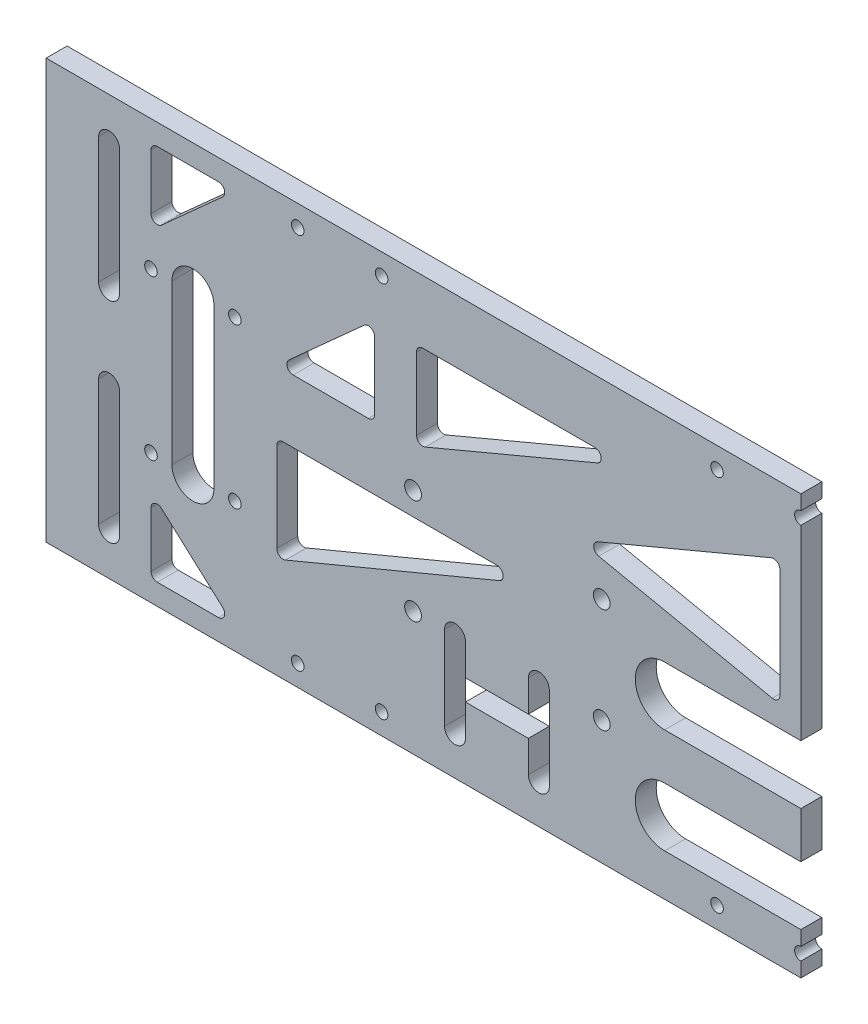
from build123d import *

# Parameters (mm, degrees)
SKETCH_1_W           = 320
SKETCH_1_H           = 121
EXTRUDE_1_DEPTH      = 5
SKETCH_2_W           = 5
SKETCH_2_H           = 30
CUT_EXTRUDE_1_DEPTH  = 343.14909031
SKETCH_3_R           = 1.5
CUT_EXTRUDE_2_DEPTH  = 343.14909031
SKETCH_4_R           = 1.5
CUT_EXTRUDE_3_DEPTH  = 343.14909031
SKETCH_6_R           = 2
CUT_EXTRUDE_5_DEPTH  = 343.14909031
SKETCH_5_W           = 250
SKETCH_5_H           = 30
CUT_EXTRUDE_4_DEPTH  = 343.14909031
SKETCH_7_W           = 260
SKETCH_7_H           = 30
EXTRUDE_2_DEPTH      = 5
SKETCH_8_W           = 320
SKETCH_8_H           = 21
CUT_EXTRUDE_6_DEPTH  = 5
SKETCH_9_W           = 15
SKETCH_9_H           = 100
EXTRUDE_3_DEPTH      = 5
CUT_EXTRUDE_7_DEPTH  = 5
CUT_EXTRUDE_8_DEPTH  = 5
SKETCH_15_R          = 1.5
CUT_EXTRUDE_9_DEPTH  = 357.217630108
SKETCH_16_W          = 5
SKETCH_16_H          = 19
CUT_EXTRUDE_10_DEPTH = 357.217630108
SKETCH_17_W          = 15
SKETCH_17_H          = 5
SKETCH_17_W_2        = 2.5
SKETCH_17_H_2        = 7.5
SKETCH_17_H_3        = 2.5
CUT_EXTRUDE_11_DEPTH = 357.217630108
SKETCH_18_W          = 5
SKETCH_18_H          = 100
EXTRUDE_4_DEPTH      = 5
SKETCH_19_W          = 180
SKETCH_19_H          = 100
CUT_EXTRUDE_13_DEPTH = 10
CUT_EXTRUDE_14_DEPTH = 10


with BuildPart() as part:
    # 草图1 → 凸台-拉伸1 (new body)
    with BuildSketch(Plane.XY):
        with Locations((160, 60.5)):
            Rectangle(SKETCH_1_W, SKETCH_1_H)
    extrude(amount=EXTRUDE_1_DEPTH)

    # 草图2 → 切除-拉伸1 (cut, through all)
    with BuildSketch(Plane.XY.offset(5)):
        with Locations((32.5, 15)):
            Rectangle(SKETCH_2_W, SKETCH_2_H)
        with Locations((287.5, 15)):
            Rectangle(SKETCH_2_W, SKETCH_2_H)
    extrude(amount=-CUT_EXTRUDE_1_DEPTH, mode=Mode.SUBTRACT)

    # 草图3 → 切除-拉伸2 (cut, through all)
    with BuildSketch(Plane.XY.offset(5)):
        with Locations((40, 116)):
            Circle(SKETCH_3_R)
        with Locations((60, 116)):
            Circle(SKETCH_3_R)
        with Locations((140, 116)):
            Circle(SKETCH_3_R)
        with Locations((160, 116)):
            Circle(SKETCH_3_R)
        with Locations(Location((260, 116, 0), (0, 0, 180))):
            Circle(SKETCH_3_R)
        with Locations(Location((280, 116, 0), (0, 0, 180))):
            Circle(SKETCH_3_R)
        with Locations(Location((180, 116, 0), (0, 0, 180))):
            Circle(SKETCH_3_R)
    extrude(amount=-CUT_EXTRUDE_2_DEPTH, mode=Mode.SUBTRACT)

    # 草图4 → 切除-拉伸3 (cut, through all)
    with BuildSketch(Plane.XY.offset(5)):
        with Locations((5, 90)):
            Circle(SKETCH_4_R)
        with Locations((25, 90)):
            Circle(SKETCH_4_R)
        with Locations((5, 10)):
            Circle(SKETCH_4_R)
        with Locations((25, 10)):
            Circle(SKETCH_4_R)
        with Locations(Location((295, 10, 0), (0, 0, 180))):
            Circle(SKETCH_4_R)
        with Locations(Location((315, 10, 0), (0, 0, 180))):
            Circle(SKETCH_4_R)
        with Locations(Location((295, 90, 0), (0, 0, 180))):
            Circle(SKETCH_4_R)
        with Locations(Location((315, 90, 0), (0, 0, 180))):
            Circle(SKETCH_4_R)
    extrude(amount=-CUT_EXTRUDE_3_DEPTH, mode=Mode.SUBTRACT)

    # 草图6 → 切除-拉伸5 (cut, through all)
    with BuildSketch(Plane.XY.offset(5)):
        with Locations((112.5, 75.5)):
            Circle(SKETCH_6_R)
        with Locations((207.5, 75.5)):
            Circle(SKETCH_6_R)
        with Locations((207.5, 50.5)):
            Circle(SKETCH_6_R)
        with Locations((112.5, 50.5)):
            Circle(SKETCH_6_R)
        with BuildLine():
            Line((127.5, 70), (192.5, 70))
            ThreePointArc((192.5, 70), (199.5, 63), (192.5, 56))
            Line((192.5, 56), (127.5, 56))
            ThreePointArc((127.5, 56), (120.5, 63), (127.5, 70))
        make_face()
    extrude(amount=-CUT_EXTRUDE_5_DEPTH, mode=Mode.SUBTRACT)

    # 草图5 → 切除-拉伸4 (cut, through all)
    with BuildSketch(Plane.XY.offset(5)):
        with BuildLine():
            Line((5, 101.368043607), (5, 114.5))
            ThreePointArc((5, 114.5), (5.439339828, 115.560660172), (6.5, 116))
            Line((6.5, 116), (21.091062659, 116))
            ThreePointArc((21.091062659, 116), (22.491493276, 115.037395651), (22.094509756, 113.385058781))
            Line((22.094509756, 113.385058781), (7.503447097, 100.253102388))
            ThreePointArc((7.503447097, 100.253102388), (5.889742123, 99.997793512), (5, 101.368043607))
        make_face()
        with BuildLine():
            Line((38.908937341, 85), (56.833333333, 85))
            ThreePointArc((56.833333333, 85), (57.893993505, 85.439339828), (58.333333333, 86.5))
            Line((58.333333333, 86.5), (58.333333333, 102.631956393))
            ThreePointArc((58.333333333, 102.631956393), (57.443591211, 104.002206488), (55.829886236, 103.746897612))
            Line((55.829886236, 103.746897612), (37.905490244, 87.614941219))
            ThreePointArc((37.905490244, 87.614941219), (37.508506724, 85.962604349), (38.908937341, 85))
        make_face()
        with BuildLine():
            Line((35, 68.5), (35, 47.25))
            ThreePointArc((35, 47.25), (35.667949706, 46.001924558), (37.076923077, 45.865384615))
            Line((37.076923077, 45.865384615), (88.076923077, 67.115384615))
            ThreePointArc((88.076923077, 67.115384615), (88.970871014, 68.794174203), (87.5, 70))
            Line((87.5, 70), (36.5, 70))
            ThreePointArc((36.5, 70), (35.439339828, 69.560660172), (35, 68.5))
        make_face()
        with Locations((160, 15)):
            Rectangle(SKETCH_5_W, SKETCH_5_H)
        with BuildLine():
            Line((68.333333333, 87.256929624), (68.333333333, 104.5))
            ThreePointArc((68.333333333, 104.5), (68.772673162, 105.560660172), (69.833333333, 106))
            Line((69.833333333, 106), (110.888262801, 106))
            ThreePointArc((110.888262801, 106), (112.358715068, 104.796260242), (111.469111528, 103.117026842))
            Line((111.469111528, 103.117026842), (70.41418206, 85.873956465))
            ThreePointArc((70.41418206, 85.873956465), (69.00305419, 86.007675228), (68.333333333, 87.256929624))
        make_face()
        with BuildLine():
            Line((111.788920254, 84.01540935), (153.193641955, 75.376872258))
            ThreePointArc((153.193641955, 75.376872258), (154.446166722, 75.68130869), (155, 76.845253935))
            Line((155, 76.845253935), (155, 102.873774141))
            ThreePointArc((155, 102.873774141), (154.330279143, 104.123028536), (152.919151273, 104.256747299))
            Line((152.919151273, 104.256747299), (111.514429572, 86.866764185))
            ThreePointArc((111.514429572, 86.866764185), (110.602180826, 85.340055375), (111.788920254, 84.01540935))
        make_face()
        with BuildLine():
            Line((167.080848727, 104.256747299), (208.485570428, 86.866764185))
            ThreePointArc((208.485570428, 86.866764185), (209.397819174, 85.340055375), (208.211079746, 84.01540935))
            Line((208.211079746, 84.01540935), (166.806358045, 75.376872258))
            ThreePointArc((166.806358045, 75.376872258), (165.553833278, 75.68130869), (165, 76.845253935))
            Line((165, 76.845253935), (165, 102.873774141))
            ThreePointArc((165, 102.873774141), (165.669720857, 104.123028536), (167.080848727, 104.256747299))
        make_face()
        with BuildLine():
            Line((208.530888472, 103.117026842), (249.58581794, 85.873956465))
            ThreePointArc((249.58581794, 85.873956465), (250.99694581, 86.007675228), (251.666666667, 87.256929624))
            Line((251.666666667, 87.256929624), (251.666666667, 104.5))
            ThreePointArc((251.666666667, 104.5), (251.227326838, 105.560660172), (250.166666667, 106))
            Line((250.166666667, 106), (209.111737199, 106))
            ThreePointArc((209.111737199, 106), (207.641284932, 104.796260242), (208.530888472, 103.117026842))
        make_face()
        with BuildLine():
            Line((232.5, 70), (283.5, 70))
            ThreePointArc((283.5, 70), (284.560660172, 69.560660172), (285, 68.5))
            Line((285, 68.5), (285, 47.25))
            ThreePointArc((285, 47.25), (284.332050294, 46.001924558), (282.923076923, 45.865384615))
            Line((282.923076923, 45.865384615), (231.923076923, 67.115384615))
            ThreePointArc((231.923076923, 67.115384615), (231.029128986, 68.794174203), (232.5, 70))
        make_face()
        with BuildLine():
            Line((264.170113764, 103.746897612), (282.094509756, 87.614941219))
            ThreePointArc((282.094509756, 87.614941219), (282.491493276, 85.962604349), (281.091062659, 85))
            Line((281.091062659, 85), (263.166666667, 85))
            ThreePointArc((263.166666667, 85), (262.106006495, 85.439339828), (261.666666667, 86.5))
            Line((261.666666667, 86.5), (261.666666667, 102.631956393))
            ThreePointArc((261.666666667, 102.631956393), (262.556408789, 104.002206488), (264.170113764, 103.746897612))
        make_face()
        with BuildLine():
            Line((297.905490244, 113.385058781), (312.496552903, 100.253102388))
            ThreePointArc((312.496552903, 100.253102388), (314.110257877, 99.997793512), (315, 101.368043607))
            Line((315, 101.368043607), (315, 114.5))
            ThreePointArc((315, 114.5), (314.560660172, 115.560660172), (313.5, 116))
            Line((313.5, 116), (298.908937341, 116))
            ThreePointArc((298.908937341, 116), (297.508506724, 115.037395651), (297.905490244, 113.385058781))
        make_face()
    extrude(amount=-CUT_EXTRUDE_4_DEPTH, mode=Mode.SUBTRACT)

    # 草图7 → 凸台-拉伸2 (add)
    with BuildSketch(Plane(origin=(0, 0, 0), x_dir=(-1, 0, 0), z_dir=(0, 0, -1))):
        with Locations((-160, 15)):
            Rectangle(SKETCH_7_W, SKETCH_7_H)
    extrude(amount=-EXTRUDE_2_DEPTH)

    # 草图8 → 切除-拉伸6 (cut)
    with BuildSketch(Plane(origin=(0, 0, 0), x_dir=(-1, 0, 0), z_dir=(0, 0, -1))):
        with Locations((-160, 10.5)):
            Rectangle(SKETCH_8_W, SKETCH_8_H)
    extrude(amount=-CUT_EXTRUDE_6_DEPTH, mode=Mode.SUBTRACT)

    # 草图9 → 凸台-拉伸3 (add)
    with BuildSketch(Plane(origin=(0, 0, 0), x_dir=(-1, 0, 0), z_dir=(0, 0, -1))):
        with Locations((-327.5, 71)):
            Rectangle(SKETCH_9_W, SKETCH_9_H)
        with Locations((7.5, 71)):
            Rectangle(SKETCH_9_W, SKETCH_9_H)
    extrude(amount=-EXTRUDE_3_DEPTH)

    # 草图10 → 切除-拉伸7 (cut)
    with BuildSketch(Plane(origin=(0, 0, 0), x_dir=(-1, 0, 0), z_dir=(0, 0, -1))):
        with BuildLine():
            Line((-325, 111), (-325, 81))
            Line((-325, 81), (-325, 78.5))
            ThreePointArc((-325, 78.5), (-323.232233047, 79.232233047), (-322.5, 81))
            Line((-322.5, 81), (-322.5, 111))
            ThreePointArc((-322.5, 111), (-323.232233047, 112.767766953), (-325, 113.5))
            Line((-325, 113.5), (-325, 111))
        make_face()
        with BuildLine():
            Line((-325, 78.5), (-325, 81))
            Line((-325, 81), (-325, 111))
            Line((-325, 111), (-325, 113.5))
            ThreePointArc((-325, 113.5), (-326.767766953, 112.767766953), (-327.5, 111))
            Line((-327.5, 111), (-327.5, 81))
            ThreePointArc((-327.5, 81), (-326.767766953, 79.232233047), (-325, 78.5))
        make_face()
        with BuildLine():
            ThreePointArc((-322.5, 61), (-323.232233047, 62.767766953), (-325, 63.5))
            Line((-325, 63.5), (-325, 61))
            Line((-325, 61), (-325, 31))
            Line((-325, 31), (-325, 28.5))
            ThreePointArc((-325, 28.5), (-323.232233047, 29.232233047), (-322.5, 31))
            Line((-322.5, 31), (-322.5, 61))
        make_face()
        with BuildLine():
            Line((-325, 61), (-325, 63.5))
            ThreePointArc((-325, 63.5), (-326.767766953, 62.767766953), (-327.5, 61))
            Line((-327.5, 61), (-327.5, 31))
            ThreePointArc((-327.5, 31), (-326.767766953, 29.232233047), (-325, 28.5))
            Line((-325, 28.5), (-325, 31))
            Line((-325, 31), (-325, 61))
        make_face()
        with BuildLine():
            Line((5, 113.5), (5, 78.5))
            ThreePointArc((5, 78.5), (6.767766953, 79.232233047), (7.5, 81))
            Line((7.5, 81), (7.5, 111))
            ThreePointArc((7.5, 111), (6.767766953, 112.767766953), (5, 113.5))
        make_face()
        with BuildLine():
            ThreePointArc((2.5, 81), (3.232233047, 79.232233047), (5, 78.5))
            Line((5, 78.5), (5, 113.5))
            ThreePointArc((5, 113.5), (3.232233047, 112.767766953), (2.5, 111))
            Line((2.5, 111), (2.5, 81))
        make_face()
        with BuildLine():
            ThreePointArc((7.5, 61), (6.767766953, 62.767766953), (5, 63.5))
            Line((5, 63.5), (5, 28.5))
            ThreePointArc((5, 28.5), (6.767766953, 29.232233047), (7.5, 31))
            Line((7.5, 31), (7.5, 61))
        make_face()
        with BuildLine():
            Line((5, 28.5), (5, 63.5))
            ThreePointArc((5, 63.5), (3.232233047, 62.767766953), (2.5, 61))
            Line((2.5, 61), (2.5, 31))
            ThreePointArc((2.5, 31), (3.232233047, 29.232233047), (5, 28.5))
        make_face()
    extrude(amount=-CUT_EXTRUDE_7_DEPTH, mode=Mode.SUBTRACT)

    # 草图13 → 切除-拉伸8 (cut)
    with BuildSketch(Plane(origin=(0, 0, 0), x_dir=(-1, 0, 0), z_dir=(0, 0, -1))):
        with BuildLine():
            Line((-192.5, 45), (-127.5, 45))
            ThreePointArc((-127.5, 45), (-120.5, 38), (-127.5, 31))
            Line((-127.5, 31), (-192.5, 31))
            ThreePointArc((-192.5, 31), (-199.5, 38), (-192.5, 45))
        make_face()
    extrude(amount=-CUT_EXTRUDE_8_DEPTH, mode=Mode.SUBTRACT)

    # 草图15 → 切除-拉伸9 (cut, through all)
    with BuildSketch(Plane(origin=(0, 0, 0), x_dir=(-1, 0, 0), z_dir=(0, 0, -1))):
        with Locations((-315, 52)):
            Circle(SKETCH_15_R)
        with BuildLine():
            ThreePointArc((-315, 40.631956393), (-314.110257877, 42.002206488), (-312.496552903, 41.746897612))
            Line((-312.496552903, 41.746897612), (-297.905490244, 28.614941219))
            ThreePointArc((-297.905490244, 28.614941219), (-297.508506724, 26.962604349), (-298.908937341, 26))
            Line((-298.908937341, 26), (-313.5, 26))
            ThreePointArc((-313.5, 26), (-314.560660172, 26.439339828), (-315, 27.5))
            Line((-315, 27.5), (-315, 40.631956393))
        make_face()
        with Locations((-295, 52)):
            Circle(SKETCH_15_R)
        with Locations((-280, 26)):
            Circle(SKETCH_15_R)
        with Locations((-260, 26)):
            Circle(SKETCH_15_R)
        with Locations((-180, 26)):
            Circle(SKETCH_15_R)
        with Locations((-160, 26)):
            Circle(SKETCH_15_R)
        with Locations((-140, 26)):
            Circle(SKETCH_15_R)
        with Locations((-60, 26)):
            Circle(SKETCH_15_R)
        with Locations((-40, 26)):
            Circle(SKETCH_15_R)
        with BuildLine():
            ThreePointArc((-21.091062659, 26), (-22.491493276, 26.962604349), (-22.094509756, 28.614941219))
            Line((-22.094509756, 28.614941219), (-7.503447097, 41.746897612))
            ThreePointArc((-7.503447097, 41.746897612), (-5.889742123, 42.002206488), (-5, 40.631956393))
            Line((-5, 40.631956393), (-5, 27.5))
            ThreePointArc((-5, 27.5), (-5.439339828, 26.439339828), (-6.5, 26))
            Line((-6.5, 26), (-21.091062659, 26))
        make_face()
        with Locations((-5, 52)):
            Circle(SKETCH_15_R)
        with Locations((-25, 52)):
            Circle(SKETCH_15_R)
    extrude(amount=-CUT_EXTRUDE_9_DEPTH, mode=Mode.SUBTRACT)

    # 草图16 → 切除-拉伸10 (cut, through all)
    with BuildSketch(Plane(origin=(0, 0, 0), x_dir=(-1, 0, 0), z_dir=(0, 0, -1))):
        with Locations((-302.5, 61.5)):
            Rectangle(SKETCH_16_W, SKETCH_16_H)
        with BuildLine():
            Line((-305, 52), (-310, 52))
            ThreePointArc((-310, 52), (-305, 47), (-300, 52))
            Line((-300, 52), (-305, 52))
        make_face()
        with Locations((-307.5, 61.5)):
            Rectangle(SKETCH_16_W, SKETCH_16_H)
        with Locations((-302.5, 80.5)):
            Rectangle(SKETCH_16_W, SKETCH_16_H)
        with Locations((-307.5, 80.5)):
            Rectangle(SKETCH_16_W, SKETCH_16_H)
        with BuildLine():
            ThreePointArc((-300, 90), (-305, 95), (-310, 90))
            Line((-310, 90), (-305, 90))
            Line((-305, 90), (-300, 90))
        make_face()
        with BuildLine():
            Line((-10, 71), (-20, 71))
            Line((-20, 71), (-20, 52))
            ThreePointArc((-20, 52), (-15, 47), (-10, 52))
            Line((-10, 52), (-10, 71))
        make_face()
        with BuildLine():
            Line((-20, 90), (-20, 71))
            Line((-20, 71), (-10, 71))
            Line((-10, 71), (-10, 90))
            ThreePointArc((-10, 90), (-15, 95), (-20, 90))
        make_face()
    extrude(amount=-CUT_EXTRUDE_10_DEPTH, mode=Mode.SUBTRACT)

    # 草图17 → 切除-拉伸11 (cut, through all)
    with BuildSketch(Plane(origin=(0, 0, 0), x_dir=(-1, 0, 0), z_dir=(0, 0, -1))):
        with BuildLine():
            Line((-77.5, 38), (-80, 38))
            Line((-80, 38), (-80, 30.5))
            ThreePointArc((-80, 30.5), (-77.5, 28), (-75, 30.5))
            Line((-75, 30.5), (-75, 40.5))
            ThreePointArc((-75, 40.5), (-75.732233047, 38.732233047), (-77.5, 38))
        make_face()
        with BuildLine():
            Line((-77.5, 43), (-80, 43))
            Line((-80, 43), (-80, 38))
            Line((-80, 38), (-77.5, 38))
            ThreePointArc((-77.5, 38), (-75.732233047, 38.732233047), (-75, 40.5))
            ThreePointArc((-75, 40.5), (-75.732233047, 42.267766953), (-77.5, 43))
        make_face()
        with BuildLine():
            Line((-80, 50.5), (-80, 43))
            Line((-80, 43), (-77.5, 43))
            ThreePointArc((-77.5, 43), (-75.732233047, 42.267766953), (-75, 40.5))
            Line((-75, 40.5), (-75, 50.5))
            ThreePointArc((-75, 50.5), (-77.5, 53), (-80, 50.5))
        make_face()
        with Locations((-87.5, 40.5)):
            Rectangle(SKETCH_17_W, SKETCH_17_H)
        with BuildLine():
            ThreePointArc((-97.5, 43), (-99.267766921, 42.267766985), (-100, 40.500000091))
            ThreePointArc((-100, 40.500000091), (-99.267766985, 38.732233079), (-97.5, 38))
            Line((-97.5, 38), (-95, 38))
            Line((-95, 38), (-95, 43))
            Line((-95, 43), (-97.5, 43))
        make_face()
        with BuildLine():
            ThreePointArc((-95, 50.5), (-97.5, 53), (-100, 50.5))
            Line((-100, 50.5), (-100, 40.500000091))
            ThreePointArc((-100, 40.500000091), (-99.267766921, 42.267766985), (-97.5, 43))
            Line((-97.5, 43), (-95, 43))
            Line((-95, 43), (-95, 50.5))
        make_face()
        with BuildLine():
            ThreePointArc((-97.5, 38), (-99.267766985, 38.732233079), (-100, 40.500000091))
            Line((-100, 40.500000091), (-100, 30.5))
            ThreePointArc((-100, 30.5), (-97.5, 28), (-95, 30.5))
            Line((-95, 30.5), (-95, 38))
            Line((-95, 38), (-97.5, 38))
        make_face()
        with Locations((-241.25, 46.75)):
            Rectangle(SKETCH_17_W_2, SKETCH_17_H_2)
        with BuildLine():
            Line((-242.5, 43), (-242.5, 50.5))
            Line((-242.5, 50.5), (-245, 50.5))
            Line((-245, 50.5), (-245, 40.5))
            ThreePointArc((-245, 40.5), (-244.267766953, 42.267766953), (-242.5, 43))
        make_face()
        with BuildLine():
            Line((-242.5, 50.5), (-240, 50.5))
            ThreePointArc((-240, 50.5), (-242.5, 53), (-245, 50.5))
            Line((-245, 50.5), (-242.5, 50.5))
        make_face()
        with Locations((-232.5, 41.75)):
            Rectangle(SKETCH_17_W, SKETCH_17_H_3)
        with Locations((-241.25, 41.75)):
            Rectangle(SKETCH_17_W_2, SKETCH_17_H_3)
        with BuildLine():
            Line((-242.5, 40.5), (-242.5, 43))
            ThreePointArc((-242.5, 43), (-244.267766953, 42.267766953), (-245, 40.5))
            Line((-245, 40.5), (-242.5, 40.5))
        make_face()
        with BuildLine():
            Line((-242.5, 40.5), (-245, 40.5))
            ThreePointArc((-245, 40.5), (-244.267766953, 38.732233047), (-242.5, 38))
            Line((-242.5, 38), (-242.5, 40.5))
        make_face()
        with Locations((-241.25, 39.25)):
            Rectangle(SKETCH_17_W_2, SKETCH_17_H_3)
        with Locations((-232.5, 39.25)):
            Rectangle(SKETCH_17_W, SKETCH_17_H_3)
        with Locations((-241.25, 34.25)):
            Rectangle(SKETCH_17_W_2, SKETCH_17_H_2)
        with BuildLine():
            ThreePointArc((-242.5, 38), (-244.267766953, 38.732233047), (-245, 40.5))
            Line((-245, 40.5), (-245, 30.5))
            Line((-245, 30.5), (-242.5, 30.5))
            Line((-242.5, 30.5), (-242.5, 38))
        make_face()
        with BuildLine():
            ThreePointArc((-245, 30.5), (-242.5, 28), (-240, 30.5))
            Line((-240, 30.5), (-242.5, 30.5))
            Line((-242.5, 30.5), (-245, 30.5))
        make_face()
        with BuildLine():
            ThreePointArc((-225, 30.5), (-222.5, 28), (-220, 30.5))
            Line((-220, 30.5), (-222.5, 30.5))
            Line((-222.5, 30.5), (-225, 30.5))
        make_face()
        with BuildLine():
            Line((-220, 30.5), (-220, 40.5))
            ThreePointArc((-220, 40.5), (-220.732233047, 38.732233047), (-222.5, 38))
            Line((-222.5, 38), (-222.5, 30.5))
            Line((-222.5, 30.5), (-220, 30.5))
        make_face()
        with Locations((-223.75, 34.25)):
            Rectangle(SKETCH_17_W_2, SKETCH_17_H_2)
        with Locations((-223.75, 39.25)):
            Rectangle(SKETCH_17_W_2, SKETCH_17_H_3)
        with BuildLine():
            ThreePointArc((-222.5, 38), (-220.732233047, 38.732233047), (-220, 40.5))
            Line((-220, 40.5), (-222.5, 40.5))
            Line((-222.5, 40.5), (-222.5, 38))
        make_face()
        with BuildLine():
            Line((-222.5, 40.5), (-220, 40.5))
            ThreePointArc((-220, 40.5), (-220.732233047, 42.267766953), (-222.5, 43))
            Line((-222.5, 43), (-222.5, 40.5))
        make_face()
        with Locations((-223.75, 41.75)):
            Rectangle(SKETCH_17_W_2, SKETCH_17_H_3)
        with Locations((-223.75, 46.75)):
            Rectangle(SKETCH_17_W_2, SKETCH_17_H_2)
        with BuildLine():
            Line((-220, 40.5), (-220, 50.5))
            Line((-220, 50.5), (-222.5, 50.5))
            Line((-222.5, 50.5), (-222.5, 43))
            ThreePointArc((-222.5, 43), (-220.732233047, 42.267766953), (-220, 40.5))
        make_face()
        with BuildLine():
            Line((-222.5, 50.5), (-220, 50.5))
            ThreePointArc((-220, 50.5), (-222.5, 53), (-225, 50.5))
            Line((-225, 50.5), (-222.5, 50.5))
        make_face()
    extrude(amount=-CUT_EXTRUDE_11_DEPTH, mode=Mode.SUBTRACT)

    # 草图18 → 凸台-拉伸4 (add)
    with BuildSketch(Plane(origin=(0, 0, 0), x_dir=(-1, 0, 0), z_dir=(0, 0, -1))):
        with Locations((-337.5, 71)):
            Rectangle(SKETCH_18_W, SKETCH_18_H)
        with Locations((17.5, 71)):
            Rectangle(SKETCH_18_W, SKETCH_18_H)
    extrude(amount=-EXTRUDE_4_DEPTH)

    # 草图19 → 切除-拉伸13 (cut)
    with BuildSketch(Plane.XY.offset(5)):
        with Locations((250, 71)):
            Rectangle(SKETCH_19_W, SKETCH_19_H)
    extrude(amount=-CUT_EXTRUDE_13_DEPTH, mode=Mode.SUBTRACT)

    # 草图20 → 切除-拉伸14 (cut)
    with BuildSketch(Plane.XY.offset(5)):
        with BuildLine():
            ThreePointArc((65.5, 75.5), (67.5, 73.5), (69.5, 75.5))
            Line((69.5, 75.5), (67.5, 75.5))
            Line((67.5, 75.5), (65.5, 75.5))
        make_face()
        with BuildLine():
            Line((67.5, 75.5), (69.5, 75.5))
            ThreePointArc((69.5, 75.5), (67.5, 77.5), (65.5, 75.5))
            Line((65.5, 75.5), (67.5, 75.5))
        make_face()
        with BuildLine():
            ThreePointArc((65.5, 50.5), (67.5, 48.5), (69.5, 50.5))
            Line((69.5, 50.5), (67.5, 50.5))
            Line((67.5, 50.5), (65.5, 50.5))
        make_face()
        with BuildLine():
            Line((67.5, 50.5), (69.5, 50.5))
            ThreePointArc((69.5, 50.5), (67.5, 52.5), (65.5, 50.5))
            Line((65.5, 50.5), (67.5, 50.5))
        make_face()
    extrude(amount=-CUT_EXTRUDE_14_DEPTH, mode=Mode.SUBTRACT)


solid = part.part
